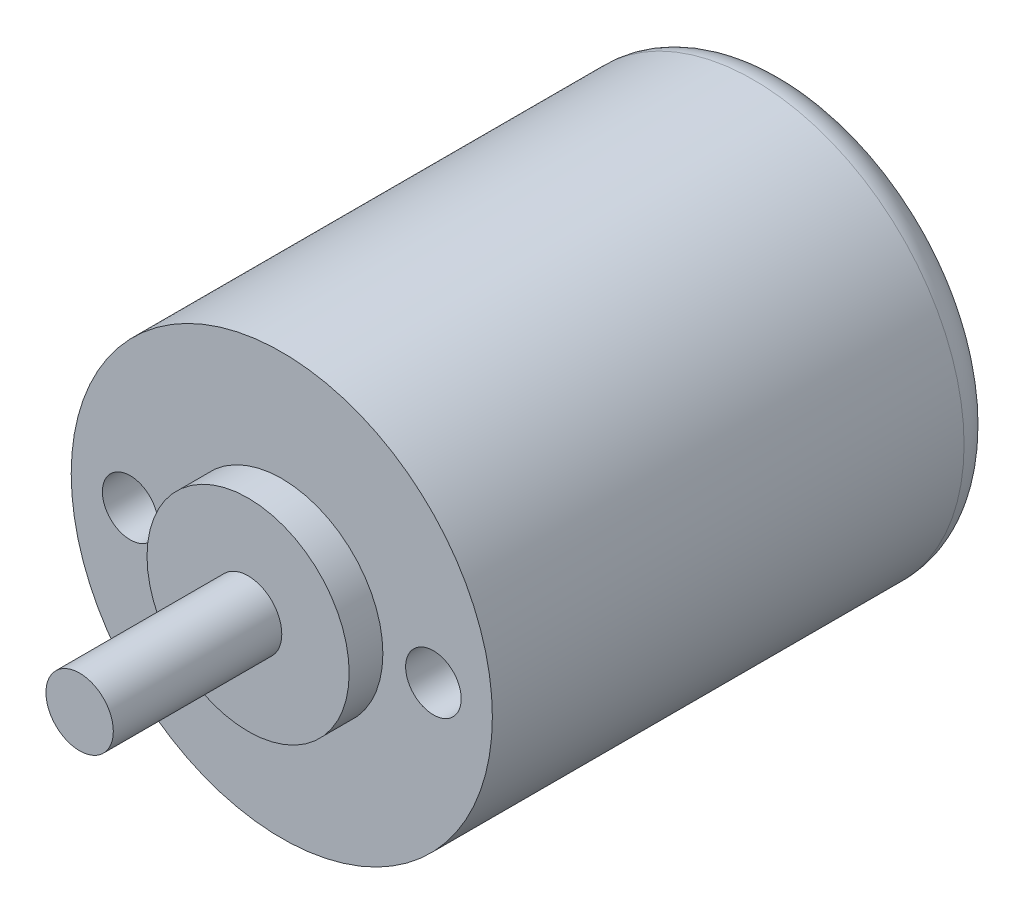
from build123d import *

# Parameters (mm, degrees)
SKETCH_1_R          = 12.5
EXTRUDE_1_DEPTH     = 30
SKETCH_3_R          = 1.65
CUT_EXTRUDE_1_DEPTH = 4
SKETCH_4_R          = 6
EXTRUDE_2_DEPTH     = 2
SKETCH_5_R          = 2
EXTRUDE_3_DEPTH     = 10
FILLET_1_R          = 2


with BuildPart() as part:
    # 草图1 → 凸台-拉伸1 (new body)
    with BuildSketch(Plane.XY):
        Circle(SKETCH_1_R)
    extrude(amount=EXTRUDE_1_DEPTH)

    # 草图3 → 切除-拉伸1 (cut)
    with BuildSketch(Plane.XY.offset(30)):
        with Locations((-9, 0)):
            Circle(SKETCH_3_R)
        with Locations((9, 0)):
            Circle(SKETCH_3_R)
    extrude(amount=-CUT_EXTRUDE_1_DEPTH, mode=Mode.SUBTRACT)

    # 草图4 → 凸台-拉伸2 (add)
    with BuildSketch(Plane.XY.offset(30)):
        Circle(SKETCH_4_R)
    extrude(amount=EXTRUDE_2_DEPTH)

    # 草图5 → 凸台-拉伸3 (add)
    with BuildSketch(Plane.XY.offset(32)):
        Circle(SKETCH_5_R)
    extrude(amount=EXTRUDE_3_DEPTH)

    # 圆角1
    fillet_1_edges = [part.edges().sort_by_distance(p)[0] for p in [
        (-12.5, 0, 0),
    ]]
    fillet(fillet_1_edges, radius=FILLET_1_R)


solid = part.part
